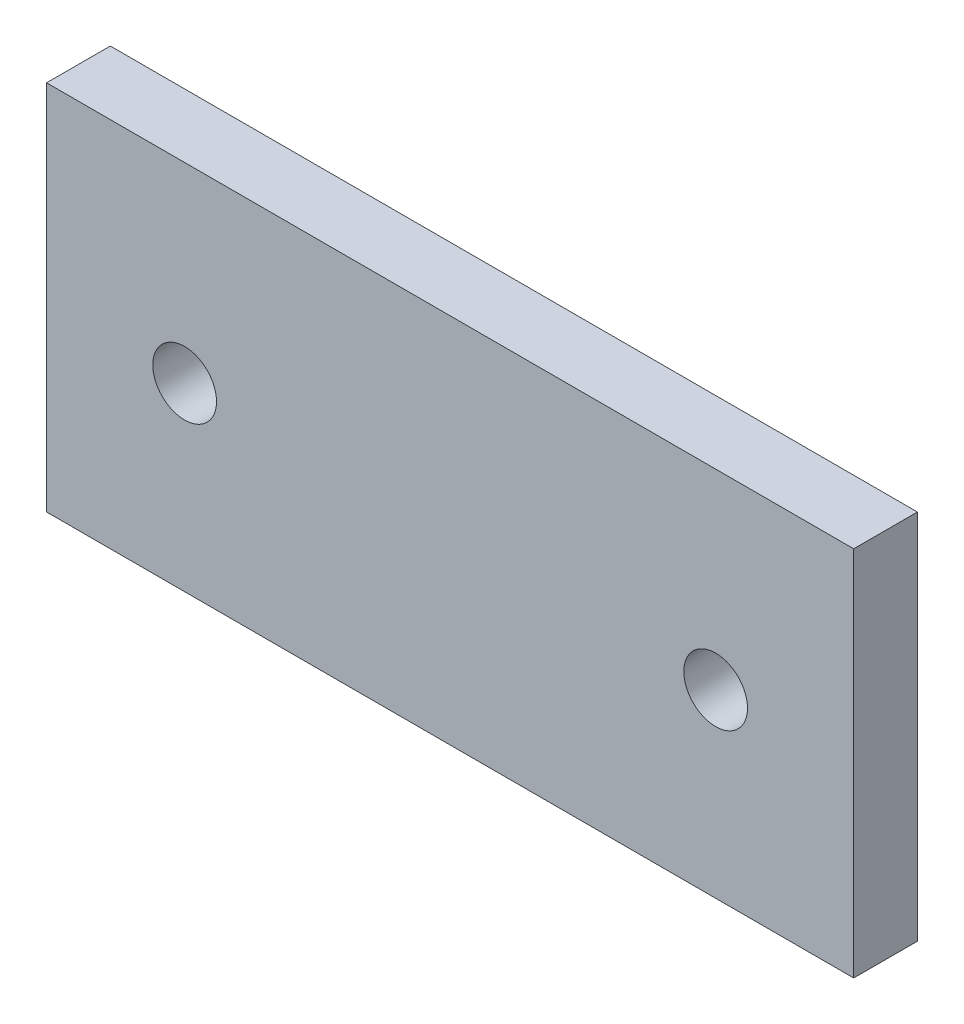
from build123d import *

# Parameters (mm, degrees)
SKETCH1_W           = 76
SKETCH1_H           = 35
BOSS_EXTRUDE1_DEPTH = 6
SKETCH2_R           = 3
CUT_EXTRUDE1_DEPTH  = 6


with BuildPart() as part:
    # Sketch1 → Boss-Extrude1 (new body)
    with BuildSketch(Plane.XY):
        with Locations((-38, 17.5)):
            Rectangle(SKETCH1_W, SKETCH1_H)
    extrude(amount=BOSS_EXTRUDE1_DEPTH)

    # Sketch2 → Cut-Extrude1 (cut)
    with BuildSketch(Plane.XY.offset(6)):
        with Locations((-13, 17)):
            Circle(SKETCH2_R)
        with Locations((-63, 17)):
            Circle(SKETCH2_R)
    extrude(amount=-CUT_EXTRUDE1_DEPTH, mode=Mode.SUBTRACT)


solid = part.part
